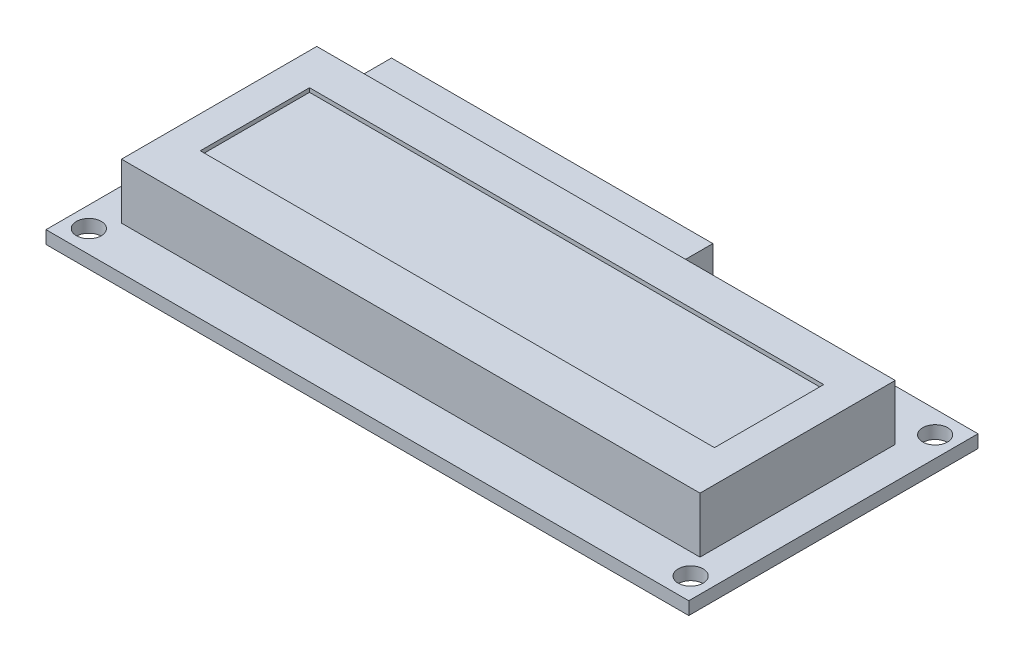
from build123d import *

# Parameters (mm, degrees)
SKETCH1_W                = 80
SKETCH1_H                = 36
BOSS_EXTRUDE1_DEPTH      = 1.6
SKETCH2_W                = 72
SKETCH2_H                = 24.3
BOSS_EXTRUDE2_DEPTH      = 6.9
SKETCH3_W                = 64
SKETCH3_H                = 13.6
CUT_EXTRUDE1_DEPTH       = 0.5
BOSS_EXTRUDE3_DEPTH      = 4
BOSS_EXTRUDE3_DEPTH_BACK = 7
SKETCH5_W                = 40
SKETCH5_H                = 4
SKETCH7_R                = 1.55
CUT_EXTRUDE2_DEPTH       = 45.418464629
SKETCH8_W                = 40
SKETCH8_H                = 5.4
BOSS_EXTRUDE4_DEPTH      = 10


with BuildPart() as part:
    # Sketch1 → Boss-Extrude1 (new body)
    with BuildSketch(Plane(origin=(0, 0, 0), x_dir=(1, 0, 0), z_dir=(0, 1, 0))):
        Rectangle(SKETCH1_W, SKETCH1_H)
    extrude(amount=BOSS_EXTRUDE1_DEPTH)

    # Sketch2 → Boss-Extrude2 (add)
    with BuildSketch(Plane(origin=(0, 1.6, 0), x_dir=(1, 0, 0), z_dir=(0, 1, 0))):
        with Locations((0, -0.45)):
            Rectangle(SKETCH2_W, SKETCH2_H)
    extrude(amount=BOSS_EXTRUDE2_DEPTH)

    # Sketch3 → Cut-Extrude1 (cut)
    with BuildSketch(Plane(origin=(0, 8.5, 0), x_dir=(1, 0, 0), z_dir=(0, 1, 0))):
        Rectangle(SKETCH3_W, SKETCH3_H)
    extrude(amount=-CUT_EXTRUDE1_DEPTH, mode=Mode.SUBTRACT)

    # Sketch5 → Boss-Extrude3 (add, two sides: drawn at the far end of the back side and taken through both)
    with BuildSketch(Plane(origin=(0, 1.6, 0), x_dir=(1, 0, 0), z_dir=(0, 1, 0)).offset(-BOSS_EXTRUDE3_DEPTH_BACK)):
        with Locations((-13, 16)):
            Rectangle(SKETCH5_W, SKETCH5_H)
    extrude(amount=BOSS_EXTRUDE3_DEPTH + BOSS_EXTRUDE3_DEPTH_BACK)

    # Sketch7 → Cut-Extrude2 (cut, through all)
    with BuildSketch(Plane(origin=(0, 1.6, 0), x_dir=(1, 0, 0), z_dir=(0, 1, 0))):
        with Locations(Location((-37.45, 15.216322293, 0), (0, 0, 270))):
            Circle(SKETCH7_R)
        with Locations(Location((37.45, 15.216322293, 0), (0, 0, 90))):
            Circle(SKETCH7_R)
        with Locations(Location((37.45, -15.216322293, 0), (0, 0, 270))):
            Circle(SKETCH7_R)
        with Locations(Location((-37.45, -15.216322293, 0), (0, 0, 90))):
            Circle(SKETCH7_R)
    extrude(amount=-CUT_EXTRUDE2_DEPTH, mode=Mode.SUBTRACT)

    # Sketch8 → Boss-Extrude4 (add)
    with BuildSketch(Plane.XY.offset(-14)):
        with Locations((-13, -2.7)):
            Rectangle(SKETCH8_W, SKETCH8_H)
    extrude(amount=BOSS_EXTRUDE4_DEPTH)


solid = part.part
